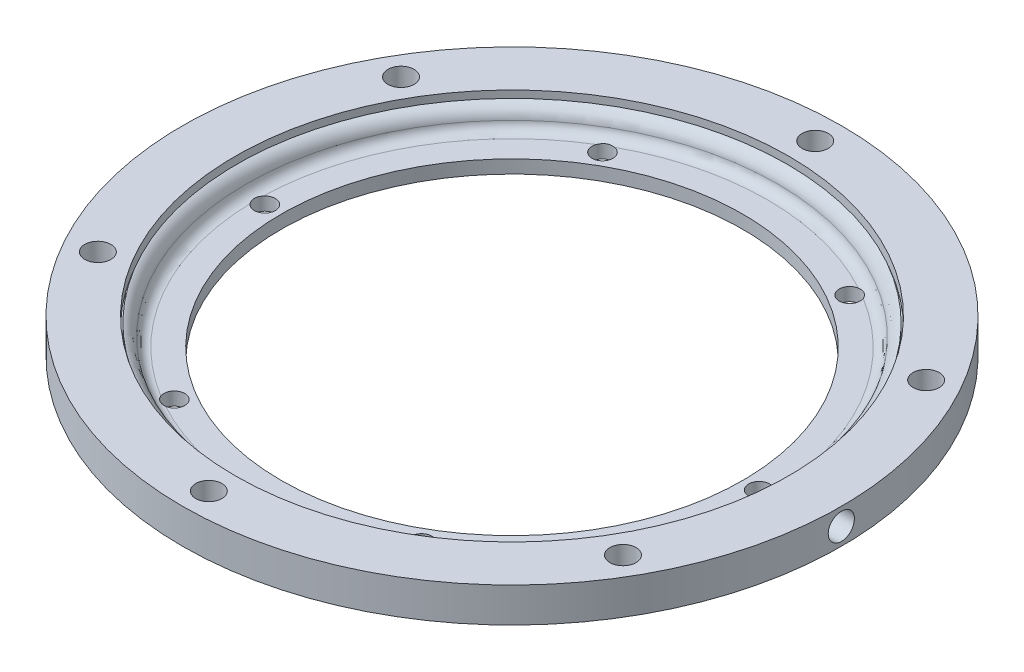
from build123d import *

# Parameters (mm, degrees)
CUT_EXTRUDE1_REACH            = 143.948
CUT_EXTRUDE1_END_MAJOR_RADIUS = 77.5
CUT_EXTRUDE1_END_MINOR_RADIUS = 6.879187563
CIRPATTERN1_COUNT             = 6
CUT_EXTRUDE2_DEPTH            = 10
CIRPATTERN2_COUNT             = 6
SKETCH5_R                     = 3.175
CUT_EXTRUDE3_DEPTH            = 142.659894334
CIRPATTERN3_COUNT             = 6
SKETCH8_W                     = 9
SKETCH8_H                     = 10
REVOLVE3_ANGLE                = 5
SKETCH7_W                     = 14.5
SKETCH7_H                     = 3.96875
SKETCH9_R                     = 3.96875
CUT_EXTRUDE4_DEPTH            = 142.948106385
CIRPATTERN4_COUNT             = 6


with BuildPart() as part:
    # Sketch1 → Revolve2 (revolve)
    with BuildSketch(Plane.XY, mode=Mode.PRIVATE) as revolve2_sk:
        with BuildLine():
            Line((100, 12.2174), (100, 1.695399962))
            Line((100, 1.695399962), (87, 1.695399962))
            Line((87, 1.695399962), (87, 3.733424016))
            ThreePointArc((87, 3.733424016), (87.706637091, 7.634268042), (84, 9.040241574))
            Line((84, 9.040241574), (84, 12.2174))
            Line((84, 12.2174), (100, 12.2174))
        make_face()
        with BuildLine():
            Line((70.016, 0), (85.5, 0))
            Line((85.5, 0), (85.5, 3.047991585))
            ThreePointArc((85.5, 3.047991585), (82.079009367, 5.093311468), (83.5, 8.817193308))
            Line((83.5, 8.817193308), (83.5, 10.348503769))
            ThreePointArc((83.5, 10.348503769), (81.503709036, 8.931809073), (80.54437696, 6.679724829))
            ThreePointArc((80.54437696, 6.679724829), (79.527877969, 4.76535961), (77.5, 4))
            Line((77.5, 4), (70.016, 4))
            Line((70.016, 4), (70.016, 0))
        make_face()
    revolve(revolve2_sk.sketch.rotate(Axis((0, 8.550989641, 0), (0, -1, 0)), 90), axis=Axis((0, 8.550989641, 0), (0, -1, 0)))

    # Cut-Extrude1: up to this torus (the profile starts outside it)
    cut_extrude1_end = Plane(origin=(0, 7.069187563, 0), z_dir=(0, 1, 0)) * Torus(CUT_EXTRUDE1_END_MAJOR_RADIUS, CUT_EXTRUDE1_END_MINOR_RADIUS, mode=Mode.PRIVATE)
    # Sketch2 → Cut-Extrude1 (cut, up to the surface)
    with BuildSketch(Plane.XZ, mode=Mode.PRIVATE) as cut_extrude1_sk1:
        with BuildLine():
            ThreePointArc((45.109081678, -56.137999663), (62.367685479, -36.008), (71.171474665, -10.996610843))
            ThreePointArc((71.171474665, -10.996610843), (77.428553314, -6.414310388), (82.010853769, -12.671389037))
            ThreePointArc((82.010853769, -12.671389037), (71.866252004, -41.49199994), (51.979171692, -64.687788232))
            ThreePointArc((51.979171692, -64.687788232), (44.269232401, -63.847938954), (45.109081678, -56.137999663))
        make_face()
    cut_extrude1_tool1 = extrude(cut_extrude1_sk1.sketch, amount=-CUT_EXTRUDE1_REACH, mode=Mode.PRIVATE) - cut_extrude1_end
    cut_extrude1 = cut_extrude1_tool1.solids().sort_by_distance((65.198689, 0, -37.642481))[0]
    add(cut_extrude1, mode=Mode.SUBTRACT)

    # CirPattern1: Cut-Extrude1 ×6 about axis
    cirpattern1_axis = Axis((0, 0, 0), (0, 1, 0))
    for i in range(1, CIRPATTERN1_COUNT):
        add(cut_extrude1.rotate(cirpattern1_axis, i * 360 / CIRPATTERN1_COUNT), mode=Mode.SUBTRACT)

    # Sketch3 → Cut-Extrude2 (cut)
    with BuildSketch(Plane.XZ.offset(-1.695399962)):
        with BuildLine():
            Line((88.56039894, 41.964934644), (80.737865341, 37.448592765))
            ThreePointArc((80.737865341, 37.448592765), (89, 0), (80.737865341, -37.448592765))
            Line((80.737865341, -37.448592765), (88.56039894, -41.964934644))
            ThreePointArc((88.56039894, -41.964934644), (98, 0), (88.56039894, 41.964934644))
        make_face()
    cut_extrude2 = extrude(amount=-CUT_EXTRUDE2_DEPTH, mode=Mode.SUBTRACT)

    # CirPattern2: Cut-Extrude2 ×6 about axis
    cirpattern2_axis = Axis((0, 0, 0), (0, 1, 0))
    for i in range(1, CIRPATTERN2_COUNT):
        add(cut_extrude2.rotate(cirpattern2_axis, i * 360 / CIRPATTERN2_COUNT), mode=Mode.SUBTRACT)

    # Sketch5 → Cut-Extrude3 (cut, symmetric)
    with BuildSketch(Plane(origin=(0, 4, 0), x_dir=(-1, 0, 0), z_dir=(0, 1, 0))):
        with Locations(Location((-37.499999994, -64.951905273, 0), (0, 0, 90))):
            Circle(SKETCH5_R)
    cut_extrude3 = extrude(amount=CUT_EXTRUDE3_DEPTH, both=True, mode=Mode.SUBTRACT)

    # CirPattern3: Cut-Extrude3 ×6 about axis
    cirpattern3_axis = Axis((0, 0, 0), (0, 1, 0))
    for i in range(1, CIRPATTERN3_COUNT):
        add(cut_extrude3.rotate(cirpattern3_axis, i * 360 / CIRPATTERN3_COUNT), mode=Mode.SUBTRACT)

    # Sketch8 → Revolve3 (revolve, symmetric)
    with BuildSketch(Plane.XY) as revolve3_sk:
        with Locations((93.5, 6.695399962)):
            Rectangle(SKETCH8_W, SKETCH8_H)
    revolve(axis=Axis((0, 29.518266566, 0), (0, -1, 0)), revolution_arc=REVOLVE3_ANGLE / 2)
    revolve(revolve3_sk.sketch, axis=Axis((0, 29.518266566, 0), (0, 1, 0)), revolution_arc=REVOLVE3_ANGLE / 2)

    # Sketch7 → Cut-Revolve3 (revolve, cut)
    with BuildSketch(Plane.XY, mode=Mode.PRIVATE) as cut_revolve3_sk:
        with Locations((92.75, 8.940774981)):
            Rectangle(SKETCH7_W, SKETCH7_H)
    revolve(cut_revolve3_sk.sketch.rotate(Axis((100, 6.956399981, 0), (1, 0, 0)), 180), axis=Axis((100, 6.956399981, 0), (1, 0, 0)), mode=Mode.SUBTRACT)

    # Sketch9 → Cut-Extrude4 (cut, through all)
    with BuildSketch(Plane(origin=(0, 12.2174, 0), x_dir=(-1, 0, 0), z_dir=(0, 1, 0))):
        with Locations(Location((-79.673473894, -45.9995016, 0), (0, 0, 90))):
            Circle(SKETCH9_R)
    cut_extrude4 = extrude(amount=-CUT_EXTRUDE4_DEPTH, mode=Mode.SUBTRACT)

    # CirPattern4: Cut-Extrude4 ×6 about axis
    cirpattern4_axis = Axis((0, 0, 0), (0, 1, 0))
    for i in range(1, CIRPATTERN4_COUNT):
        add(cut_extrude4.rotate(cirpattern4_axis, i * 360 / CIRPATTERN4_COUNT), mode=Mode.SUBTRACT)


solid = part.part
